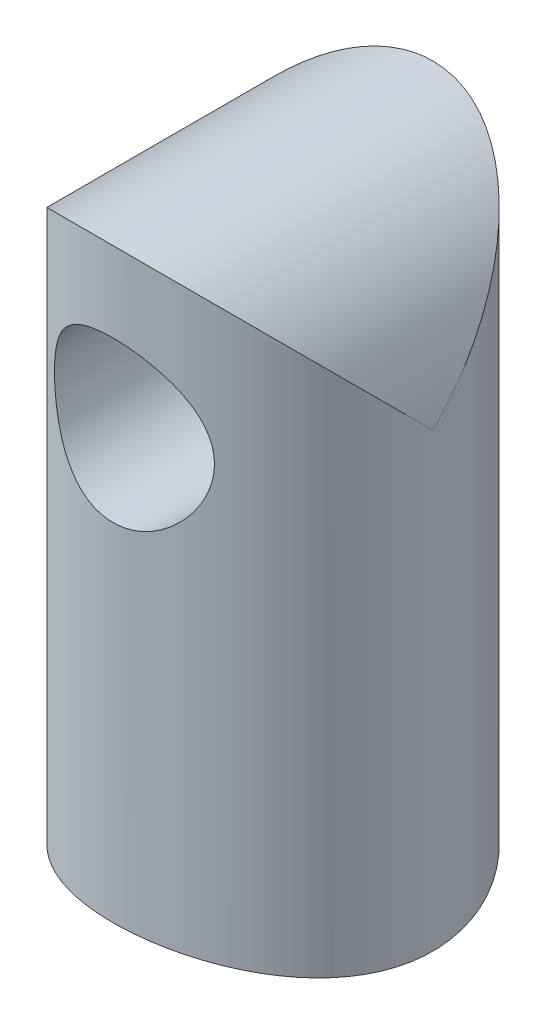
from build123d import *

# Parameters (mm, degrees)
SKETCH1_R               = 9.525
BOSS_EXTRUDE1_DEPTH     = 38.1
CUT_EXTRUDE1_DEPTH      = 41.411152545
CUT_EXTRUDE1_DEPTH_BACK = 41.411152545
SKETCH2_R               = 31.75
SKETCH2_R_2             = 4.7625


with BuildPart() as part:
    # Sketch1 → Boss-Extrude1 (new body)
    with BuildSketch(Plane(origin=(0, 0, 0), x_dir=(1, 0, 0), z_dir=(0, 1, 0))):
        with Locations(Location((0, 0, 0), (0, 0, 90))):
            Circle(SKETCH1_R)
    extrude(amount=BOSS_EXTRUDE1_DEPTH)

    # Sketch2 → Cut-Extrude1 (cut, two sides: drawn at the far end of the back side and taken through both)
    with BuildSketch(Plane.XY.offset(-CUT_EXTRUDE1_DEPTH_BACK)):
        with Locations((0, -30.287569645)):
            Circle(SKETCH2_R)
        with Locations((0, 26.862430355)):
            Circle(SKETCH2_R_2)
        with BuildLine():
            Line((-9.525, 26.862430355), (-9.525, 38.1))
            Line((-9.525, 38.1), (9.525, 38.1))
            Line((9.525, 38.1), (9.525, 26.862430355))
            ThreePointArc((9.525, 26.862430355), (0, 36.387430355), (-9.525, 26.862430355))
        make_face()
    extrude(amount=CUT_EXTRUDE1_DEPTH + CUT_EXTRUDE1_DEPTH_BACK, mode=Mode.SUBTRACT)


solid = part.part
